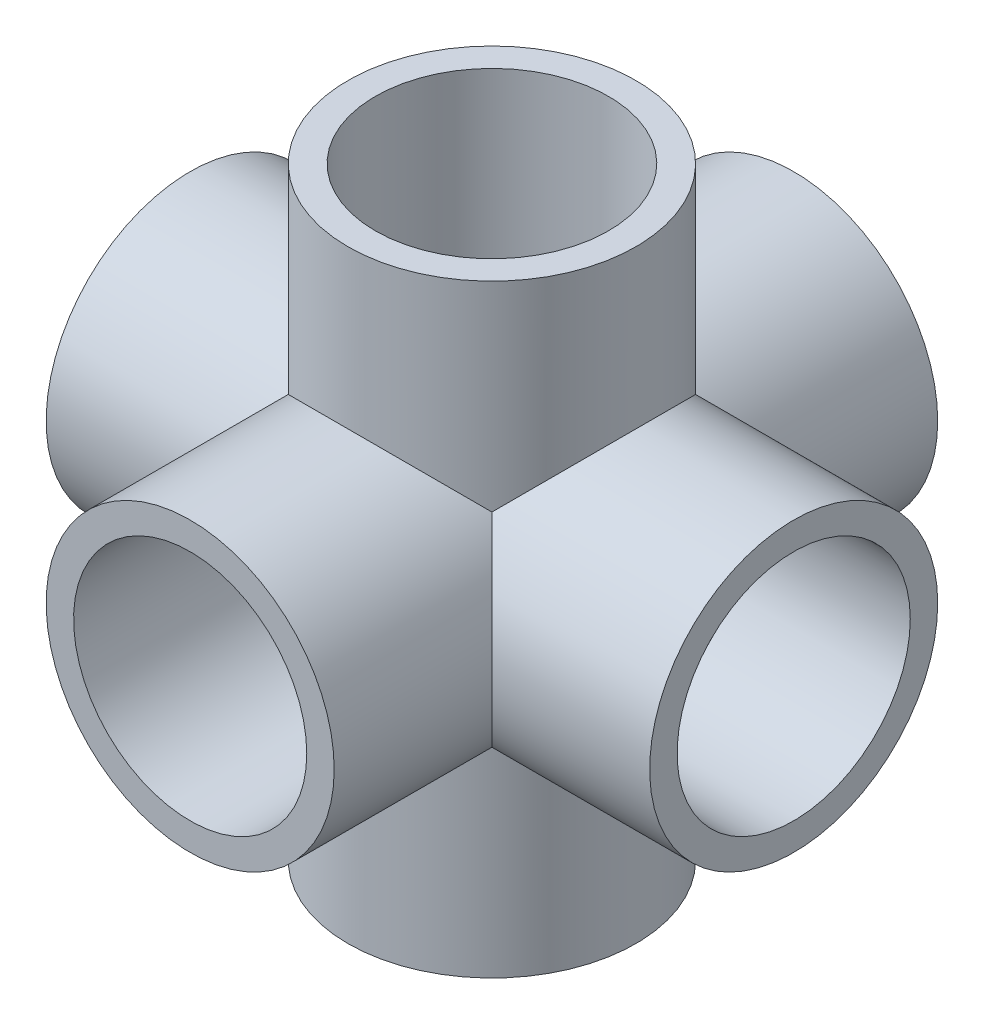
from build123d import *
from build123d.topology import SkipClean

# Parameters (mm, degrees)
SKETCH1_R               = 16.66875
BOSS_EXTRUDE1_DEPTH     = 69.85
CUT_EXTRUDE1_DEPTH      = 74.720532778
CUT_EXTRUDE1_DEPTH_BACK = 26.9875
SKETCH3_R               = 13.49375
SKETCH4_R               = 16.66875
BOSS_EXTRUDE2_DEPTH     = 34.925
SKETCH5_R               = 12.7
CUT_EXTRUDE2_DEPTH      = 101.179300459
CUT_EXTRUDE8_START      = 19.05
SKETCH11_R              = 13.49375
CUT_EXTRUDE8_DEPTH      = 19.05
CUT_EXTRUDE5_DEPTH      = 80.853774811
CUT_EXTRUDE5_DEPTH_BACK = 80.853774811
SKETCH10_R              = 12.7
SKETCH13_R              = 13.49375
CUT_EXTRUDE9_DEPTH      = 19.05
CUT_EXTRUDE10_START     = -19.05
SKETCH14_R              = 13.49375
CUT_EXTRUDE10_DEPTH     = 19.05
SKETCH15_R              = 16.66875
BOSS_EXTRUDE3_DEPTH     = 34.925
SKETCH16_R              = 12.7
CUT_EXTRUDE11_DEPTH     = 105.7750001
SKETCH17_R              = 13.49375
CUT_EXTRUDE12_DEPTH     = 19.05
CUT_EXTRUDE13_START     = -19.05
SKETCH18_R              = 13.49375
CUT_EXTRUDE13_DEPTH     = 19.05
SKETCH19_R              = 12.7
CUT_EXTRUDE14_DEPTH     = 105.775000133
SKETCH20_R              = 12.7
CUT_EXTRUDE15_DEPTH     = 86.548429389


with BuildPart() as part:
    # Sketch1 → Boss-Extrude1 (new body)
    with BuildSketch(Plane.XY):
        Circle(SKETCH1_R)
    extrude(amount=BOSS_EXTRUDE1_DEPTH)

    # Sketch3 → Cut-Extrude1 (cut, two sides: drawn at the far end of the back side and taken through both)
    with BuildSketch(Plane.XY.offset(69.85).offset(-CUT_EXTRUDE1_DEPTH_BACK)):
        with Locations(Location((0, 0, 0), (0, 0, 180))):
            Circle(SKETCH3_R)
    extrude(amount=CUT_EXTRUDE1_DEPTH + CUT_EXTRUDE1_DEPTH_BACK, mode=Mode.SUBTRACT)

    # Sketch4 → Boss-Extrude2 (add, symmetric)
    with BuildSketch(Plane(origin=(0, 0, 0), x_dir=(0, 0, -1), z_dir=(1, 0, 0))):
        with Locations(Location((-34.925, 0, 0), (0, 0, 270))):
            Circle(SKETCH4_R)
    extrude(amount=BOSS_EXTRUDE2_DEPTH, both=True)

    # Sketch5 → Cut-Extrude2 (cut, through all)
    with BuildSketch(Plane(origin=(34.925, 0, 0), x_dir=(0, 0, -1), z_dir=(1, 0, 0))):
        with Locations((-34.925, 0)):
            Circle(SKETCH5_R)
    extrude(amount=-CUT_EXTRUDE2_DEPTH, mode=Mode.SUBTRACT)

    # Sketch11 → Cut-Extrude8 (cut)
    with BuildSketch(Plane.XY.offset(CUT_EXTRUDE8_START)):
        with Locations(Location((0, 0, 0), (0, 0, 180))):
            Circle(SKETCH11_R)
    extrude(amount=-CUT_EXTRUDE8_DEPTH, mode=Mode.SUBTRACT)

    # Sketch10 → Cut-Extrude5 (cut, two sides: drawn at the far end of the back side and taken through both)
    with BuildSketch(Plane.XY.offset(69.85).offset(-CUT_EXTRUDE5_DEPTH_BACK)):
        Circle(SKETCH10_R)
    extrude(amount=CUT_EXTRUDE5_DEPTH + CUT_EXTRUDE5_DEPTH_BACK, mode=Mode.SUBTRACT)

    # Sketch13 → Cut-Extrude9 (cut)
    with BuildSketch(Plane(origin=(34.925, 0, 0), x_dir=(0, 0, -1), z_dir=(1, 0, 0))):
        with Locations((-34.925, 0)):
            Circle(SKETCH13_R)
    extrude(amount=-CUT_EXTRUDE9_DEPTH, mode=Mode.SUBTRACT)

    # Sketch14 → Cut-Extrude10 (cut)
    with BuildSketch(Plane.ZY.offset(34.925).offset(CUT_EXTRUDE10_START)):
        with Locations(Location((34.925, 0, 0), (0, 0, 180))):
            Circle(SKETCH14_R)
    extrude(amount=CUT_EXTRUDE10_DEPTH, mode=Mode.SUBTRACT)

    # Sketch15 → Boss-Extrude3 (add, symmetric)
    with BuildSketch(Plane(origin=(0, 0, 0), x_dir=(1, 0, 0), z_dir=(0, 1, 0))):
        with Locations(Location((0, -34.925, 0), (0, 0, 107.752790162))):
            Circle(SKETCH15_R)
    extrude(amount=BOSS_EXTRUDE3_DEPTH, both=True)

    # Sketch16 → Cut-Extrude11 (cut, through all)
    with BuildSketch(Plane(origin=(0, 34.925, 0), x_dir=(1, 0, 0), z_dir=(0, 1, 0))):
        with Locations(Location((0, -34.925, 0), (0, 0, 270))):
            Circle(SKETCH16_R)
    extrude(amount=-CUT_EXTRUDE11_DEPTH, mode=Mode.SUBTRACT)

    # Sketch17 → Cut-Extrude12 (cut)
    with BuildSketch(Plane(origin=(0, 34.925, 0), x_dir=(1, 0, 0), z_dir=(0, 1, 0))):
        with Locations(Location((0, -34.925, 0), (0, 0, 270))):
            Circle(SKETCH17_R)
    extrude(amount=-CUT_EXTRUDE12_DEPTH, mode=Mode.SUBTRACT)

    # Sketch18 → Cut-Extrude13 (cut)
    with BuildSketch(Plane.XZ.offset(34.925).offset(CUT_EXTRUDE13_START)):
        with Locations(Location((0, 34.925, 0), (0, 0, 90))):
            Circle(SKETCH18_R)
    extrude(amount=CUT_EXTRUDE13_DEPTH, mode=Mode.SUBTRACT)

    # Sketch19 → Cut-Extrude14 (cut, through all)
    with BuildSketch(Plane(origin=(34.925, 0, 0), x_dir=(0, 0, -1), z_dir=(1, 0, 0))):
        with Locations((-34.925, 0)):
            Circle(SKETCH19_R)
    extrude(amount=-CUT_EXTRUDE14_DEPTH, mode=Mode.SUBTRACT)

    # Sketch20 → Cut-Extrude15 (cut, through all)
    with SkipClean():  # the faces are left unmerged after this step: merging them gives an invalid solid
        with BuildSketch(Plane.XY.offset(69.85)):
            with Locations(Location((0, 0, 0), (0, 0, 315))):
                Circle(SKETCH20_R)
        extrude(amount=-CUT_EXTRUDE15_DEPTH, mode=Mode.SUBTRACT)


solid = part.part
